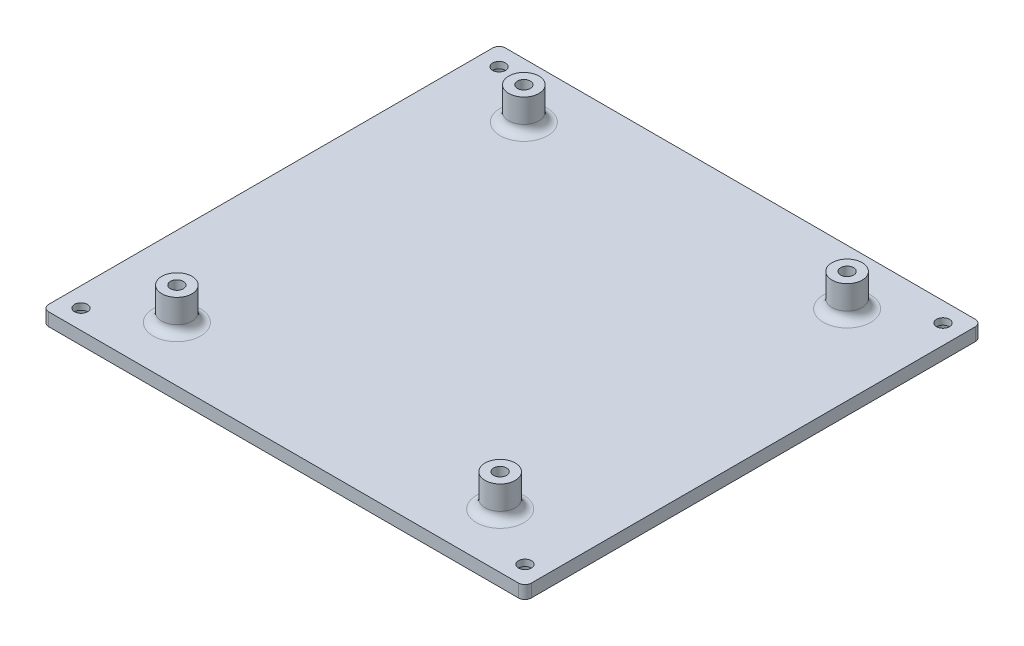
from build123d import *

# Parameters (mm, degrees)
SKETCH2_W           = 112
SKETCH2_H           = 106
BOSS_EXTRUDE1_DEPTH = 3
BOSS_EXTRUDE2_DEPTH = 7.5
SKETCH4_R           = 1.5
CUT_EXTRUDE1_DEPTH  = 5
CUT_EXTRUDE4_DEPTH  = 3
CUT_EXTRUDE5_START  = -1.5
CUT_EXTRUDE5_DEPTH  = 1.5
FILLET1_R           = 1.5
FILLET2_R           = 2


with BuildPart() as part:
    # Sketch2 → Boss-Extrude1 (new body)
    with BuildSketch(Plane(origin=(0, 0, 0), x_dir=(1, 0, 0), z_dir=(0, 1, 0))):
        Rectangle(SKETCH2_W, SKETCH2_H)
    extrude(amount=BOSS_EXTRUDE1_DEPTH)

    # Sketch3 → Boss-Extrude2 (add)
    with BuildSketch(Plane(origin=(0, 3, 0), x_dir=(1, 0, 0), z_dir=(0, 1, 0))):
        with BuildLine():
            ThreePointArc((-34, 40.25), (-39.974873734, 42.724873734), (-37.5, 36.75))
            Line((-37.5, 36.75), (-37.5, 40.25))
            Line((-37.5, 40.25), (-34, 40.25))
        make_face()
        with BuildLine():
            Line((-37.5, 40.25), (-37.5, 36.75))
            ThreePointArc((-37.5, 36.75), (-35.025126266, 37.775126266), (-34, 40.25))
            Line((-34, 40.25), (-37.5, 40.25))
        make_face()
        with BuildLine():
            ThreePointArc((34, 40.25), (35.025126266, 37.775126266), (37.5, 36.75))
            Line((37.5, 36.75), (37.5, 40.25))
            Line((37.5, 40.25), (34, 40.25))
        make_face()
        with BuildLine():
            Line((37.5, 40.25), (37.5, 36.75))
            ThreePointArc((37.5, 36.75), (39.974873734, 37.775126266), (41, 40.25))
            ThreePointArc((41, 40.25), (37.5, 43.75), (34, 40.25))
            Line((34, 40.25), (37.5, 40.25))
        make_face()
        with BuildLine():
            Line((-37.5, -36.75), (-37.5, -40.25))
            Line((-37.5, -40.25), (-34, -40.25))
            ThreePointArc((-34, -40.25), (-35.025126266, -37.775126266), (-37.5, -36.75))
        make_face()
        with BuildLine():
            Line((-34, -40.25), (-37.5, -40.25))
            Line((-37.5, -40.25), (-37.5, -36.75))
            ThreePointArc((-37.5, -36.75), (-39.974873734, -42.724873734), (-34, -40.25))
        make_face()
        with BuildLine():
            ThreePointArc((37.5, -36.75), (35.025126266, -37.775126266), (34, -40.25))
            Line((34, -40.25), (37.5, -40.25))
            Line((37.5, -40.25), (37.5, -36.75))
        make_face()
        with BuildLine():
            Line((37.5, -40.25), (34, -40.25))
            ThreePointArc((34, -40.25), (37.5, -43.75), (41, -40.25))
            ThreePointArc((41, -40.25), (39.974873734, -37.775126266), (37.5, -36.75))
            Line((37.5, -36.75), (37.5, -40.25))
        make_face()
    extrude(amount=BOSS_EXTRUDE2_DEPTH)

    # Sketch4 → Cut-Extrude1 (cut)
    with BuildSketch(Plane(origin=(0, 10.5, 0), x_dir=(1, 0, 0), z_dir=(0, 1, 0))):
        with Locations(Location((-37.5, 40.25, 0), (0, 0, 270))):
            Circle(SKETCH4_R)
        with Locations(Location((37.5, 40.25, 0), (0, 0, 270))):
            Circle(SKETCH4_R)
        with Locations(Location((37.5, -40.25, 0), (0, 0, 270))):
            Circle(SKETCH4_R)
        with Locations(Location((-37.5, -40.25, 0), (0, 0, 270))):
            Circle(SKETCH4_R)
    extrude(amount=-CUT_EXTRUDE1_DEPTH, mode=Mode.SUBTRACT)

    # Sketch6 → Cut-Extrude4 (cut)
    with BuildSketch(Plane(origin=(0, 3, 0), x_dir=(1, 0, 0), z_dir=(0, 1, 0))):
        with BuildLine():
            ThreePointArc((-50, 48.5), (-52.560660172, 49.560660172), (-51.5, 47))
            Line((-51.5, 47), (-51.5, 48.5))
            Line((-51.5, 48.5), (-50, 48.5))
        make_face()
        with BuildLine():
            Line((-51.5, 48.5), (-51.5, 47))
            ThreePointArc((-51.5, 47), (-50.439339828, 47.439339828), (-50, 48.5))
            Line((-50, 48.5), (-51.5, 48.5))
        make_face()
        with BuildLine():
            Line((-51.5, -47), (-51.5, -48.5))
            Line((-51.5, -48.5), (-50, -48.5))
            ThreePointArc((-50, -48.5), (-50.439339828, -47.439339828), (-51.5, -47))
        make_face()
        with BuildLine():
            Line((-50, -48.5), (-51.5, -48.5))
            Line((-51.5, -48.5), (-51.5, -47))
            ThreePointArc((-51.5, -47), (-52.560660172, -49.560660172), (-50, -48.5))
        make_face()
        with BuildLine():
            ThreePointArc((51.5, -47), (50.439339828, -47.439339828), (50, -48.5))
            Line((50, -48.5), (51.5, -48.5))
            Line((51.5, -48.5), (51.5, -47))
        make_face()
        with BuildLine():
            Line((51.5, -48.5), (50, -48.5))
            ThreePointArc((50, -48.5), (51.5, -50), (53, -48.5))
            ThreePointArc((53, -48.5), (52.560660172, -47.439339828), (51.5, -47))
            Line((51.5, -47), (51.5, -48.5))
        make_face()
        with BuildLine():
            ThreePointArc((50, 48.5), (50.439339828, 47.439339828), (51.5, 47))
            Line((51.5, 47), (51.5, 48.5))
            Line((51.5, 48.5), (50, 48.5))
        make_face()
        with BuildLine():
            Line((51.5, 48.5), (51.5, 47))
            ThreePointArc((51.5, 47), (52.560660172, 47.439339828), (53, 48.5))
            ThreePointArc((53, 48.5), (51.5, 50), (50, 48.5))
            Line((50, 48.5), (51.5, 48.5))
        make_face()
    extrude(amount=-CUT_EXTRUDE4_DEPTH, mode=Mode.SUBTRACT)

    # Sketch7 → Cut-Extrude5 (cut)
    with BuildSketch(Plane.XZ.offset(CUT_EXTRUDE5_START)):
        with BuildLine():
            ThreePointArc((-49, 48.5), (-53.267766953, 50.267766953), (-51.5, 46))
            Line((-51.5, 46), (-51.5, 47))
            ThreePointArc((-51.5, 47), (-52.560660172, 49.560660172), (-50, 48.5))
            Line((-50, 48.5), (-49, 48.5))
        make_face()
        with BuildLine():
            Line((-51.5, 47), (-51.5, 46))
            ThreePointArc((-51.5, 46), (-49.732233047, 46.732233047), (-49, 48.5))
            Line((-49, 48.5), (-50, 48.5))
            ThreePointArc((-50, 48.5), (-50.439339828, 47.439339828), (-51.5, 47))
        make_face()
        with BuildLine():
            ThreePointArc((-50, 48.5), (-52.560660172, 49.560660172), (-51.5, 47))
            Line((-51.5, 47), (-51.5, 48.5))
            Line((-51.5, 48.5), (-50, 48.5))
        make_face()
        with BuildLine():
            Line((-51.5, 48.5), (-51.5, 47))
            ThreePointArc((-51.5, 47), (-50.439339828, 47.439339828), (-50, 48.5))
            Line((-50, 48.5), (-51.5, 48.5))
        make_face()
        with BuildLine():
            Line((-51.5, -47), (-51.5, -48.5))
            Line((-51.5, -48.5), (-50, -48.5))
            ThreePointArc((-50, -48.5), (-50.439339828, -47.439339828), (-51.5, -47))
        make_face()
        with BuildLine():
            Line((-50, -48.5), (-51.5, -48.5))
            Line((-51.5, -48.5), (-51.5, -47))
            ThreePointArc((-51.5, -47), (-52.560660172, -49.560660172), (-50, -48.5))
        make_face()
        with BuildLine():
            ThreePointArc((-51.5, -47), (-50.439339828, -47.439339828), (-50, -48.5))
            Line((-50, -48.5), (-49, -48.5))
            ThreePointArc((-49, -48.5), (-49.732233047, -46.732233047), (-51.5, -46))
            Line((-51.5, -46), (-51.5, -47))
        make_face()
        with BuildLine():
            Line((-49, -48.5), (-50, -48.5))
            ThreePointArc((-50, -48.5), (-52.560660172, -49.560660172), (-51.5, -47))
            Line((-51.5, -47), (-51.5, -46))
            ThreePointArc((-51.5, -46), (-53.267766953, -50.267766953), (-49, -48.5))
        make_face()
        with BuildLine():
            ThreePointArc((51.5, -46), (49.732233047, -46.732233047), (49, -48.5))
            Line((49, -48.5), (50, -48.5))
            ThreePointArc((50, -48.5), (50.439339828, -47.439339828), (51.5, -47))
            Line((51.5, -47), (51.5, -46))
        make_face()
        with BuildLine():
            Line((50, -48.5), (49, -48.5))
            ThreePointArc((49, -48.5), (51.5, -51), (54, -48.5))
            ThreePointArc((54, -48.5), (53.267766953, -46.732233047), (51.5, -46))
            Line((51.5, -46), (51.5, -47))
            ThreePointArc((51.5, -47), (52.560660172, -47.439339828), (53, -48.5))
            ThreePointArc((53, -48.5), (51.5, -50), (50, -48.5))
        make_face()
        with BuildLine():
            ThreePointArc((51.5, -47), (50.439339828, -47.439339828), (50, -48.5))
            Line((50, -48.5), (51.5, -48.5))
            Line((51.5, -48.5), (51.5, -47))
        make_face()
        with BuildLine():
            Line((51.5, -48.5), (50, -48.5))
            ThreePointArc((50, -48.5), (51.5, -50), (53, -48.5))
            ThreePointArc((53, -48.5), (52.560660172, -47.439339828), (51.5, -47))
            Line((51.5, -47), (51.5, -48.5))
        make_face()
        with BuildLine():
            ThreePointArc((50, 48.5), (50.439339828, 47.439339828), (51.5, 47))
            Line((51.5, 47), (51.5, 48.5))
            Line((51.5, 48.5), (50, 48.5))
        make_face()
        with BuildLine():
            Line((51.5, 48.5), (51.5, 47))
            ThreePointArc((51.5, 47), (52.560660172, 47.439339828), (53, 48.5))
            ThreePointArc((53, 48.5), (51.5, 50), (50, 48.5))
            Line((50, 48.5), (51.5, 48.5))
        make_face()
        with BuildLine():
            ThreePointArc((49, 48.5), (49.732233047, 46.732233047), (51.5, 46))
            Line((51.5, 46), (51.5, 47))
            ThreePointArc((51.5, 47), (50.439339828, 47.439339828), (50, 48.5))
            Line((50, 48.5), (49, 48.5))
        make_face()
        with BuildLine():
            Line((51.5, 47), (51.5, 46))
            ThreePointArc((51.5, 46), (53.267766953, 46.732233047), (54, 48.5))
            ThreePointArc((54, 48.5), (51.5, 51), (49, 48.5))
            Line((49, 48.5), (50, 48.5))
            ThreePointArc((50, 48.5), (51.5, 50), (53, 48.5))
            ThreePointArc((53, 48.5), (52.560660172, 47.439339828), (51.5, 47))
        make_face()
    extrude(amount=CUT_EXTRUDE5_DEPTH, mode=Mode.SUBTRACT)

    # Fillet1
    fillet1_edges = [part.edges().sort_by_distance(p)[0] for p in [
        (56, 1.5, 53),
        (-56, 1.5, 53),
        (-56, 1.5, -53),
        (56, 1.5, -53),
    ]]
    fillet(fillet1_edges, radius=FILLET1_R)

    # Fillet2
    fillet2_edges = [part.edges().sort_by_distance(p)[0] for p in [
        (-37.5, 3, -43.75),
        (41, 3, -40.25),
        (-41, 3, 40.25),
        (37.5, 3, 43.75),
    ]]
    fillet(fillet2_edges, radius=FILLET2_R)


solid = part.part
